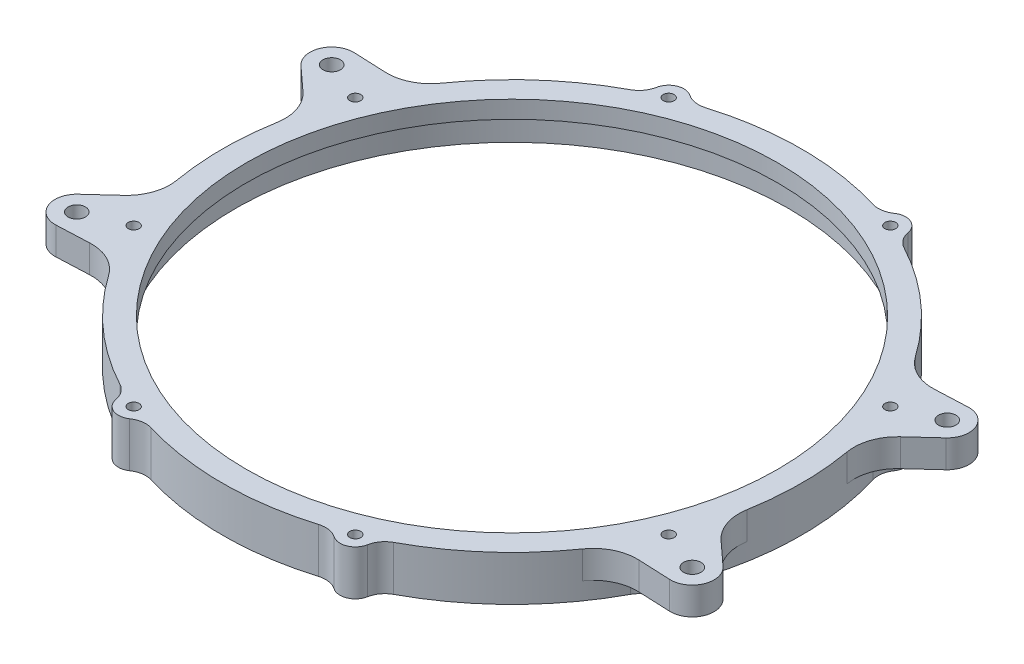
from build123d import *

# Parameters (mm, degrees)
SKETCH_3_R               = 1.2000000000000004
SKETCH_3_R_2             = 1.2000000000000013
SKETCH_3_R_3             = 1.5000000000000242
SKETCH_3_R_4             = 1.5000000000000009
SKETCH_3_R_5             = 61
EXTRUDE_1_DEPTH          = 10.35
SKETCH_4_R               = 63.5
CUT_EXTRUDE_1_DEPTH      = 6.35
SKETCH_5_OUTSIDE_W       = 177.056
SKETCH_5_OUTSIDE_H       = 206.606
CUT_EXTRUDE_2_DEPTH      = 13.5
FILLET_1_R               = 5
HOLE_WIZARD_M3_1_D       = 2.5
SKETCH_8_R               = 1.9999999999999967
EXTRUDE_2_DEPTH          = 10.35
CUT_EXTRUDE_3_DEPTH      = 4
MIRROR_3_COPY_1_SKETCH_R = 1.9999999999999967
MIRROR_3_COPY_1_DEPTH    = 10.35
MIRROR_3_COPY_2_DEPTH    = 4
FILLET_5_R               = 5
FILLET_6_R               = 10


with BuildPart() as part:
    # 草图3 → 凸台-拉伸1 (new body)
    with BuildSketch(Plane(origin=(0, 0, 0), x_dir=(1, 0, 0), z_dir=(0, 1, 0))):
        with BuildLine():
            Line((20.525188543884052, -90.75404721026199), (28.226021624875667, -73.04213112398133))
            ThreePointArc((28.226021624875667, -73.04213112398133), (30.98047768282304, -71.09585986209694), (30.52518854388408, -67.75404721026199))
            Line((30.52518854388408, -67.75404721026199), (35.548149363750866, -56.20123732456839))
            ThreePointArc((35.548149363750866, -56.20123732456839), (49.727828901626786, -44.15193124576241), (60.0139665899743, -28.6456596038117))
            ThreePointArc((60.0139665899743, -28.6456596038117), (64.67156727578998, -26.78784026555657), (62.69182289909034, -22.180742584257473))
            ThreePointArc((62.69182289909034, -22.180742584257473), (66.5, -2.3256e-13), (62.69182289909049, 22.180742584257032))
            ThreePointArc((62.69182289909049, 22.180742584257032), (64.67156727579017, 26.787840265556113), (60.01396658997451, 28.645659603811282))
            ThreePointArc((60.01396658997451, 28.645659603811282), (47.022600948905506, 47.022600948905335), (28.645659603811488, 60.013966589974395))
            ThreePointArc((28.645659603811488, 60.013966589974395), (26.78784026555635, 64.67156727579005), (22.180742584257256, 62.69182289909042))
            ThreePointArc((22.180742584257256, 62.69182289909042), (2.9939e-13, 66.50000000000001), (-22.180742584256677, 62.69182289909062))
            ThreePointArc((-22.180742584256677, 62.69182289909062), (-26.78784026555642, 64.67156727579057), (-28.645659603811836, 60.01396658997424))
            ThreePointArc((-28.645659603811836, 60.01396658997424), (-47.022600948905314, 47.02260094890553), (-60.013966589974096, 28.64565960381212))
            ThreePointArc((-60.013966589974096, 28.64565960381212), (-64.67156727578978, 26.787840265557023), (-62.691822899090184, 22.18074258425791))
            ThreePointArc((-62.691822899090184, 22.18074258425791), (-66.5, 7.1691e-13), (-62.691822899090646, -22.180742584256603))
            ThreePointArc((-62.691822899090646, -22.180742584256603), (-64.67156727579035, -26.787840265555676), (-60.01396658997469, -28.645659603810863))
            ThreePointArc((-60.01396658997469, -28.645659603810863), (-49.72782890162709, -44.15193124576207), (-35.548149363750866, -56.20123732456839))
            Line((-35.548149363750866, -56.20123732456839), (-30.52518854388408, -67.75404721026199))
            ThreePointArc((-30.52518854388408, -67.75404721026199), (-30.98047768282304, -71.09585986209694), (-28.226021624875667, -73.04213112398133))
            Line((-28.226021624875667, -73.04213112398133), (-20.525188543884052, -90.75404721026199))
            ThreePointArc((-20.525188543884052, -90.75404721026199), (-20.12401787680613, -95.25988781431347), (-15.607825257218895, -95.00000000000003))
            Line((-15.607825257218895, -95.00000000000003), (15.607825257218895, -95.00000000000003))
            ThreePointArc((15.607825257218895, -95.00000000000003), (20.124017876806132, -95.25988781431347), (20.525188543884052, -90.75404721026199))
        make_face()
        with Locations(Location((25.448448252278425, -61.4379889120006, 0), (0, 0, 270))):
            Circle(SKETCH_3_R, mode=Mode.SUBTRACT)
        with Locations(Location((61.437988912000556, -25.448448252278524, 0), (0, 0, 270))):
            Circle(SKETCH_3_R_2, mode=Mode.SUBTRACT)
        with Locations(Location((61.4379889120006, 25.44844825227842, 0), (0, 0, 270))):
            Circle(SKETCH_3_R_2, mode=Mode.SUBTRACT)
        with Locations(Location((25.44844825227853, 61.437988912000556, 0), (0, 0, 270))):
            Circle(SKETCH_3_R, mode=Mode.SUBTRACT)
        with Locations(Location((28.000000000000025, -69.79999999999998, 0), (0, 0, 270))):
            Circle(SKETCH_3_R_3, mode=Mode.SUBTRACT)
        with Locations(Location((-25.44844825227842, 61.4379889120006, 0), (0, 0, 270))):
            Circle(SKETCH_3_R, mode=Mode.SUBTRACT)
        with Locations(Location((-61.437988912000556, 25.448448252278517, 0), (0, 0, 270))):
            Circle(SKETCH_3_R, mode=Mode.SUBTRACT)
        with Locations(Location((-61.4379889120006, -25.44844825227843, 0), (0, 0, 270))):
            Circle(SKETCH_3_R, mode=Mode.SUBTRACT)
        with Locations(Location((-25.448448252278524, -61.43798891200056, 0), (0, 0, 270))):
            Circle(SKETCH_3_R, mode=Mode.SUBTRACT)
        with Locations(Location((18, -92.8, 0), (0, 0, 270))):
            Circle(SKETCH_3_R_4, mode=Mode.SUBTRACT)
        with Locations(Location((-18, -92.8, 0), (0, 0, 270))):
            Circle(SKETCH_3_R_4, mode=Mode.SUBTRACT)
        with Locations(Location((-28.000000000000025, -69.79999999999998, 0), (0, 0, 270))):
            Circle(SKETCH_3_R_3, mode=Mode.SUBTRACT)
        with Locations(Location((0, 0, 0), (0, 0, 270))):
            Circle(SKETCH_3_R_5, mode=Mode.SUBTRACT)
        with BuildLine():
            Line((17.77397837512435, -89.55786887601865), (25.474811456115958, -71.84595278973799))
            ThreePointArc((25.474811456115958, -71.84595278973799), (24.924182150706564, -68.75031216165574), (27.25242619569793, -66.63714789989771))
            Line((27.25242619569793, -66.63714789989771), (26.787840265555875, -64.67156727579027))
            ThreePointArc((26.787840265555875, -64.67156727579027), (24.066621440757885, -64.65366219499515), (22.18074258425679, -62.691822899090575))
            ThreePointArc((22.18074258425679, -62.691822899090575), (12.740539746326242, -65.26812887598572), (3.0244665692366857, -66.43118696795632))
            Line((3.0244665692366857, -66.43118696795632), (17.521179997190814, -89.5854656006025))
            ThreePointArc((17.521179997190814, -89.5854656006025), (17.647309165371013, -89.56919372676592), (17.77397837512435, -89.55786887601865))
        make_face(mode=Mode.SUBTRACT)
        with BuildLine():
            Line((-4.8473e-13, -66.5), (15.31746684460521, -90.96519323355083))
            ThreePointArc((15.31746684460521, -90.96519323355083), (15.03819024696604, -91.46202280033145), (14.850000000000001, -91.99999999999999))
            Line((14.850000000000001, -91.99999999999999), (-14.850000000000001, -91.99999999999999))
            ThreePointArc((-14.850000000000001, -91.99999999999999), (-15.03819024696604, -91.46202280033145), (-15.31746684460521, -90.96519323355083))
            Line((-15.31746684460521, -90.96519323355083), (-4.8473e-13, -66.5))
        make_face(mode=Mode.SUBTRACT)
        with BuildLine():
            Line((-17.521179997190814, -89.5854656006025), (-3.0244665692366857, -66.43118696795632))
            ThreePointArc((-3.0244665692366857, -66.43118696795632), (-12.740539746326712, -65.26812887598562), (-22.180742584257693, -62.691822899090255))
            ThreePointArc((-22.180742584257693, -62.691822899090255), (-24.06662144075835, -64.65366219499461), (-26.787840265555875, -64.67156727579027))
            Line((-26.787840265555875, -64.67156727579027), (-27.252426195697943, -66.63714789989771))
            ThreePointArc((-27.252426195697943, -66.63714789989771), (-24.92418215070657, -68.75031216165574), (-25.474811456115958, -71.84595278973799))
            Line((-25.474811456115958, -71.84595278973799), (-17.77397837512435, -89.55786887601865))
            ThreePointArc((-17.77397837512435, -89.55786887601865), (-17.647309165371013, -89.56919372676592), (-17.521179997190814, -89.5854656006025))
        make_face(mode=Mode.SUBTRACT)
    extrude(amount=EXTRUDE_1_DEPTH)

    # 草图4 → 切除-拉伸1 (cut)
    with BuildSketch(Plane.XZ):
        with Locations(Location((0, 0, 0), (0, 0, 270))):
            Circle(SKETCH_4_R)
    extrude(amount=-CUT_EXTRUDE_1_DEPTH, mode=Mode.SUBTRACT)

    # 草图5 outside → 切除-拉伸2 (cut)
    with BuildSketch(Plane.XZ):
        with Locations((0, 14.774999999999999)):
            Rectangle(SKETCH_5_OUTSIDE_W, SKETCH_5_OUTSIDE_H)
        with BuildLine():
            ThreePointArc((22.18074258425738, 62.69182289909037), (-5.499e-14, 66.5), (-22.180742584257484, 62.69182289909034))
            ThreePointArc((-22.180742584257484, 62.69182289909034), (-26.787840265556245, 64.67156727578984), (-28.645659603811257, 60.013966589974515))
            ThreePointArc((-28.645659603811257, 60.013966589974515), (-47.02260094890546, 47.02260094890538), (-60.01396658997458, 28.64565960381113))
            ThreePointArc((-60.01396658997458, 28.64565960381113), (-64.67156727578983, 26.787840265556138), (-62.691822899090354, 22.18074258425745))
            ThreePointArc((-62.691822899090354, 22.18074258425745), (-66.50000000000001, -5.092e-14), (-62.691822899090326, -22.18074258425754))
            ThreePointArc((-62.691822899090326, -22.18074258425754), (-64.67156727578978, -26.787840265556227), (-60.01396658997454, -28.645659603811215))
            ThreePointArc((-60.01396658997454, -28.645659603811215), (-47.02260094890537, -47.02260094890547), (-28.64565960381112, -60.01396658997458))
            ThreePointArc((-28.64565960381112, -60.01396658997458), (-26.787840265556127, -64.67156727578983), (-22.18074258425744, -62.691822899090354))
            ThreePointArc((-22.18074258425744, -62.691822899090354), (3.36e-14, -66.50000000000001), (22.180742584257526, -62.691822899090326))
            ThreePointArc((22.180742584257526, -62.691822899090326), (26.787840265556213, -64.67156727578978), (28.645659603811207, -60.01396658997454))
            ThreePointArc((28.645659603811207, -60.01396658997454), (47.022600948905456, -47.022600948905385), (60.013966589974586, -28.645659603811122))
            ThreePointArc((60.013966589974586, -28.645659603811122), (64.6715672757898, -26.78784026555612), (62.69182289909037, -22.180742584257445))
            ThreePointArc((62.69182289909037, -22.180742584257445), (66.50000000000003, 3.913e-13), (62.69182289909009, 22.18074258425818))
            ThreePointArc((62.69182289909009, 22.18074258425818), (64.67156727578914, 26.787840265555953), (60.013966589974835, 28.64565960381059))
            ThreePointArc((60.013966589974835, 28.64565960381059), (47.02260094890564, 47.0226009489052), (28.645659603811165, 60.01396658997455))
            ThreePointArc((28.645659603811165, 60.01396658997455), (26.78784026555614, 64.67156727578987), (22.18074258425738, 62.69182289909037))
        make_face(mode=Mode.SUBTRACT)
    extrude(amount=-CUT_EXTRUDE_2_DEPTH, mode=Mode.SUBTRACT)

    # 圆角1
    fillet_1_edges = [part.edges().sort_by_distance(p)[0] for p in [
        (22.18074258425679, 5.175, 62.691822899090575),
        (-22.180742584257693, 5.175, 62.691822899090255),
        (-28.64565960381126, 5.175, 60.01396658997452),
        (28.64565960381116, 5.175, 60.01396658997455),
        (-28.645659603811836, 5.175, -60.01396658997423),
        (-22.180742584256684, 5.175, -62.691822899090624),
        (22.18074258425726, 5.175, -62.691822899090425),
        (28.645659603811474, 5.175, -60.0139665899744),
    ]]
    fillet(fillet_1_edges, radius=FILLET_1_R)

    # M3 螺纹孔1 (through all)
    with Locations(Plane(origin=(0, 10.35, 0), x_dir=(1, 0, 0), z_dir=(0, 1, 0))):
        with Locations((-25.448448252, 61.437988912), (25.448448252, 61.437988912), (61.437988912, 25.448448252), (61.437988912, -25.448448252), (25.448448252, -61.437988912), (-25.448448252, -61.437988912), (-61.437988912, -25.448448252), (-61.437988912, 25.448448252)):
            Hole(HOLE_WIZARD_M3_1_D / 2)

    # 草图8 → 凸台-拉伸2 (add)
    with BuildSketch(Plane(origin=(0, 0, 0), x_dir=(1, 0, 0), z_dir=(0, 1, 0))):
        with BuildLine():
            Line((70.4586873002868, 34.27052368383861), (57.330103814889334, 33.697317349813055))
            ThreePointArc((57.330103814889334, 33.697317349813055), (58.72637845373316, 31.200360153512733), (60.0139665899745, 28.64565960381127))
            ThreePointArc((60.0139665899745, 28.64565960381127), (64.67156727579017, 26.787840265556117), (62.69182289909049, 22.180742584257032))
            ThreePointArc((62.69182289909049, 22.180742584257032), (63.587806679173745, 19.46383419915065), (64.36610677948494, 16.710903567788996))
            Line((64.36610677948494, 16.710903567788996), (74.05473527519177, 25.5888958918787))
            ThreePointArc((74.05473527519177, 25.5888958918787), (75.2961818996699, 31.18869973775476), (70.4586873002868, 34.27052368383861))
        make_face()
        with Locations(Location((70.67678423711348, 29.275282575929314, 0), (0, 0, 270))):
            Circle(SKETCH_8_R, mode=Mode.SUBTRACT)
    extrude_2 = extrude(amount=EXTRUDE_2_DEPTH)

    # 草图9 → 切除-拉伸3 (cut)
    with BuildSketch(Plane.XZ):
        with BuildLine():
            Line((70.4586873002868, -34.27052368383861), (57.33010381488933, -33.69731734981305))
            ThreePointArc((57.33010381488933, -33.69731734981305), (58.72637845373313, -31.200360153512793), (60.01396658997444, -28.64565960381138))
            ThreePointArc((60.01396658997444, -28.64565960381138), (64.6715672757901, -26.787840265556234), (62.69182289909045, -22.180742584257146))
            ThreePointArc((62.69182289909045, -22.180742584257146), (63.58780667917373, -19.463834199150707), (64.36610677948494, -16.710903567788996))
            Line((64.36610677948494, -16.710903567788996), (74.05473527519177, -25.5888958918787))
            ThreePointArc((74.05473527519177, -25.5888958918787), (75.29618189966992, -31.188699737754767), (70.4586873002868, -34.27052368383861))
        make_face()
    cut_extrude_3 = extrude(amount=-CUT_EXTRUDE_3_DEPTH, mode=Mode.SUBTRACT)

    # 镜向1: 凸台-拉伸2 across plane
    add(extrude_2.mirror(Plane.XY))

    # 镜向2: 切除-拉伸3 across plane
    add(cut_extrude_3.mirror(Plane.XY), mode=Mode.SUBTRACT)

    # 镜向3: 凸台-拉伸2, 切除-拉伸3 across plane
    add(extrude_2.mirror(Plane(origin=(0, 0, 0), x_dir=(0, 0, 1), z_dir=(1, 0, 0))))
    add(cut_extrude_3.mirror(Plane(origin=(0, 0, 0), x_dir=(0, 0, 1), z_dir=(1, 0, 0))), mode=Mode.SUBTRACT)

    # 镜向3 copy 1 sketch → 镜向3 copy 1 (add)
    with BuildSketch(Plane(origin=(0, 0, 0), x_dir=(-1, 0, 0), z_dir=(0, 1, 0))):
        with BuildLine():
            Line((70.4586873002868, 34.27052368383861), (57.330103814889334, 33.697317349813055))
            ThreePointArc((57.330103814889334, 33.697317349813055), (58.72637845373316, 31.200360153512733), (60.0139665899745, 28.64565960381127))
            ThreePointArc((60.0139665899745, 28.64565960381127), (64.67156727579017, 26.787840265556117), (62.69182289909049, 22.180742584257032))
            ThreePointArc((62.69182289909049, 22.180742584257032), (63.587806679173745, 19.46383419915065), (64.36610677948494, 16.710903567788996))
            Line((64.36610677948494, 16.710903567788996), (74.05473527519177, 25.5888958918787))
            ThreePointArc((74.05473527519177, 25.5888958918787), (75.2961818996699, 31.18869973775476), (70.4586873002868, 34.27052368383861))
        make_face()
        with Locations(Location((70.67678423711348, 29.275282575929314, 0), (0, 0, 270))):
            Circle(MIRROR_3_COPY_1_SKETCH_R, mode=Mode.SUBTRACT)
    extrude(amount=MIRROR_3_COPY_1_DEPTH)

    # 镜向3 copy 2 sketch → 镜向3 copy 2 (cut)
    with BuildSketch(Plane(origin=(0, 0, 0), x_dir=(-1, 0, 0), z_dir=(0, -1, 0))):
        with BuildLine():
            Line((70.4586873002868, -34.27052368383861), (57.33010381488933, -33.69731734981305))
            ThreePointArc((57.33010381488933, -33.69731734981305), (58.72637845373313, -31.200360153512793), (60.01396658997444, -28.64565960381138))
            ThreePointArc((60.01396658997444, -28.64565960381138), (64.6715672757901, -26.787840265556234), (62.69182289909045, -22.180742584257146))
            ThreePointArc((62.69182289909045, -22.180742584257146), (63.58780667917373, -19.463834199150707), (64.36610677948494, -16.710903567788996))
            Line((64.36610677948494, -16.710903567788996), (74.05473527519177, -25.5888958918787))
            ThreePointArc((74.05473527519177, -25.5888958918787), (75.29618189966992, -31.188699737754767), (70.4586873002868, -34.27052368383861))
        make_face()
    extrude(amount=-MIRROR_3_COPY_2_DEPTH, mode=Mode.SUBTRACT)

    # 圆角5
    fillet_5_edges = [part.edges().sort_by_distance(p)[0] for p in [
        (62.691822899090454, 2, -22.18074258425715),
        (60.013966589974444, 2, -28.64565960381138),
        (62.691822899090454, 2, 22.18074258425715),
        (60.013966589974444, 2, 28.64565960381138),
        (-62.691822899090454, 2, -22.18074258425715),
        (-60.013966589974444, 2, -28.64565960381138),
        (-62.691822899090454, 2, 22.18074258425715),
        (-60.013966589974444, 2, 28.64565960381138),
    ]]
    fillet(fillet_5_edges, radius=FILLET_5_R)

    # 圆角6
    fillet_6_edges = [part.edges().sort_by_distance(p)[0] for p in [
        (64.36610677948494, 7.175, -16.710903567788993),
        (57.33010381488934, 7.175, -33.69731734981306),
        (64.36610677948494, 7.175, 16.710903567788993),
        (57.33010381488934, 7.175, 33.69731734981306),
        (-64.36610677948494, 7.175, -16.710903567788993),
        (-57.33010381488934, 7.175, -33.69731734981306),
        (-64.36610677948494, 7.175, 16.710903567788993),
        (-57.33010381488934, 7.175, 33.69731734981306),
    ]]
    fillet(fillet_6_edges, radius=FILLET_6_R)


solid = part.part
